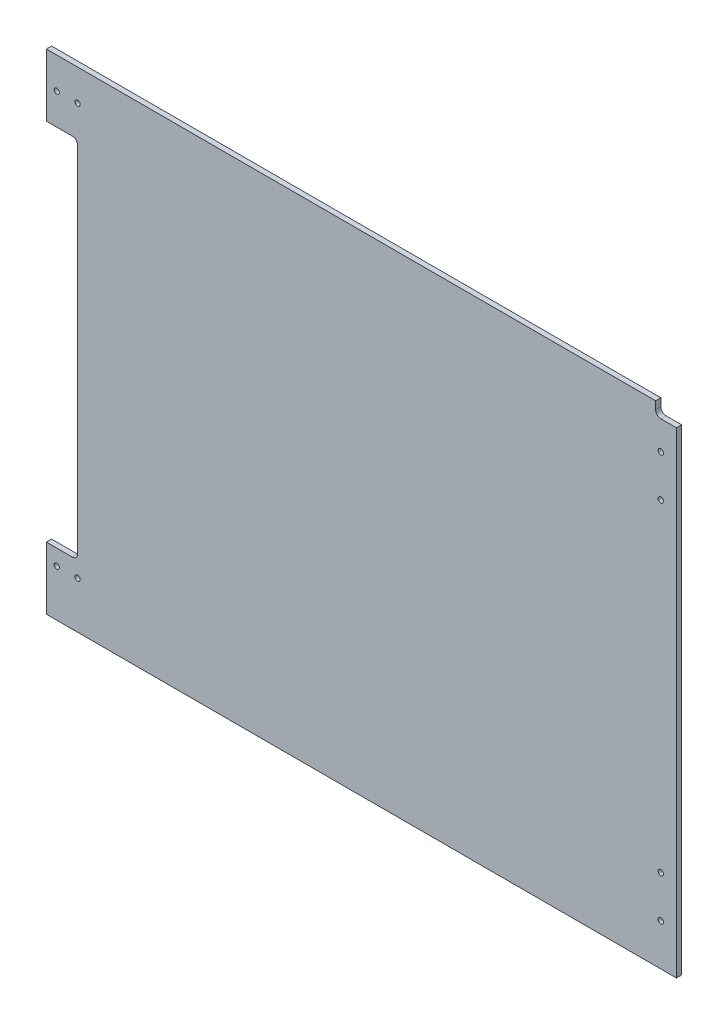
from build123d import *

# Parameters (mm, degrees)
SKETCH1_W                   = 736.6
SKETCH1_H                   = 596.9
BOSS_EXTRUDE1_DEPTH         = 6.35
SKETCH5_W                   = 31.75
SKETCH5_H                   = 76.2
BOSS_EXTRUDE2_DEPTH         = 6.35
SKETCH6_W                   = 6.35
SKETCH6_H                   = 444.5
CUT_EXTRUDE1_DEPTH          = 500.15200841
FILLET1_R                   = 6.35
F_0_257_DIAMETER_HOLE1_D    = 6.5278
F_1_4_0_25_DIAMETER_HOLE2_D = 6.35
CUT_EXTRUDE2_DEPTH          = 500.15200841


with BuildPart() as part:
    # Sketch1 → Boss-Extrude1 (new body)
    with BuildSketch(Plane.XY):
        Rectangle(SKETCH1_W, SKETCH1_H)
    extrude(amount=BOSS_EXTRUDE1_DEPTH)

    # Sketch5 → Boss-Extrude2 (add)
    with BuildSketch(Plane.XY.offset(6.35)):
        with Locations((-384.175, 260.35)):
            Rectangle(SKETCH5_W, SKETCH5_H)
        with Locations((-384.175, -260.35)):
            Rectangle(SKETCH5_W, SKETCH5_H)
    extrude(amount=-BOSS_EXTRUDE2_DEPTH)

    # Sketch6 → Cut-Extrude1 (cut, through all)
    with BuildSketch(Plane.XY.offset(6.35)):
        with Locations((-365.125, 0)):
            Rectangle(SKETCH6_W, SKETCH6_H)
    extrude(amount=-CUT_EXTRUDE1_DEPTH, mode=Mode.SUBTRACT)

    # Fillet1
    fillet1_edges = [part.edges().sort_by_distance(p)[0] for p in [
        (-361.95, -222.25, 3.175),
        (-361.95, 222.25, 3.175),
    ]]
    fillet(fillet1_edges, radius=FILLET1_R)

    # F (0.257) Diameter Hole1 (through all)
    with Locations(Plane.XY.offset(6.35)):
        with Locations((349.25, 247.65), (349.25, 196.85), (349.25, -196.85), (349.25, -247.65)):
            Hole(F_0_257_DIAMETER_HOLE1_D / 2)

    # 1/4 (0.25) Diameter Hole2 (through all)
    with Locations(Plane.XY.offset(6.35)):
        with Locations((-387.35, 260.35), (-361.95, 260.35), (-361.95, -241.3), (-387.35, -241.3)):
            Hole(F_1_4_0_25_DIAMETER_HOLE2_D / 2)

    # Sketch13 → Cut-Extrude2 (cut, through all)
    with BuildSketch(Plane.XY.offset(6.35)):
        with BuildLine():
            Line((368.3, 298.45), (342.9, 298.45))
            Line((342.9, 298.45), (342.9, 288.925))
            ThreePointArc((342.9, 288.925), (344.759871939, 284.434871939), (349.25, 282.575))
            Line((349.25, 282.575), (368.3, 282.575))
            Line((368.3, 282.575), (368.3, 298.45))
        make_face()
    extrude(amount=-CUT_EXTRUDE2_DEPTH, mode=Mode.SUBTRACT)


solid = part.part
